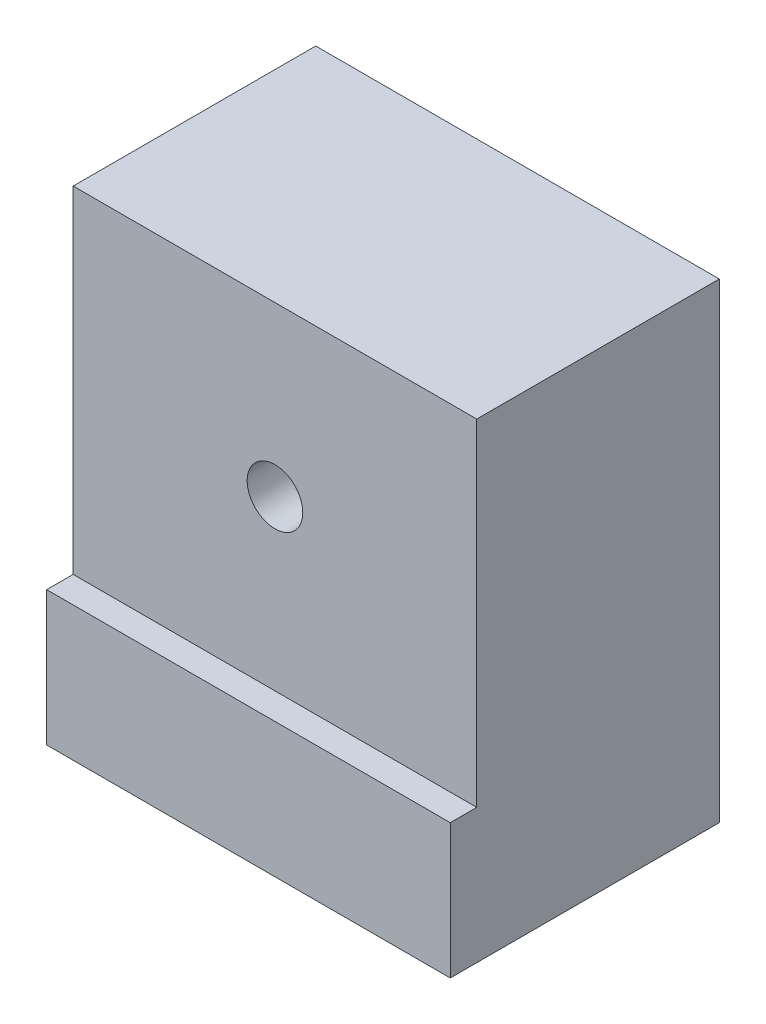
from build123d import *

# Parameters (mm, degrees)
SKETCH1_W           = 76.2
SKETCH1_H           = 50.8
BOSS_EXTRUDE1_DEPTH = 88.9
SKETCH2_R           = 5.25
CUT_EXTRUDE1_DEPTH  = 300
SKETCH3_W           = 76.2
SKETCH3_H           = 63.5
CUT_EXTRUDE2_DEPTH  = 5


with BuildPart() as part:
    # Sketch1 → Boss-Extrude1 (new body)
    with BuildSketch(Plane(origin=(0, 0, 0), x_dir=(1, 0, 0), z_dir=(0, 1, 0))):
        with Locations((38.1, 25.4)):
            Rectangle(SKETCH1_W, SKETCH1_H)
    extrude(amount=BOSS_EXTRUDE1_DEPTH)

    # Sketch2 → Cut-Extrude1 (cut)
    with BuildSketch(Plane.XY):
        with Locations((38.1, 57.15)):
            Circle(SKETCH2_R)
    extrude(amount=-CUT_EXTRUDE1_DEPTH, mode=Mode.SUBTRACT)

    # Sketch3 → Cut-Extrude2 (cut)
    with BuildSketch(Plane.XY):
        with Locations((38.1, 57.15)):
            Rectangle(SKETCH3_W, SKETCH3_H)
    extrude(amount=-CUT_EXTRUDE2_DEPTH, mode=Mode.SUBTRACT)


solid = part.part
